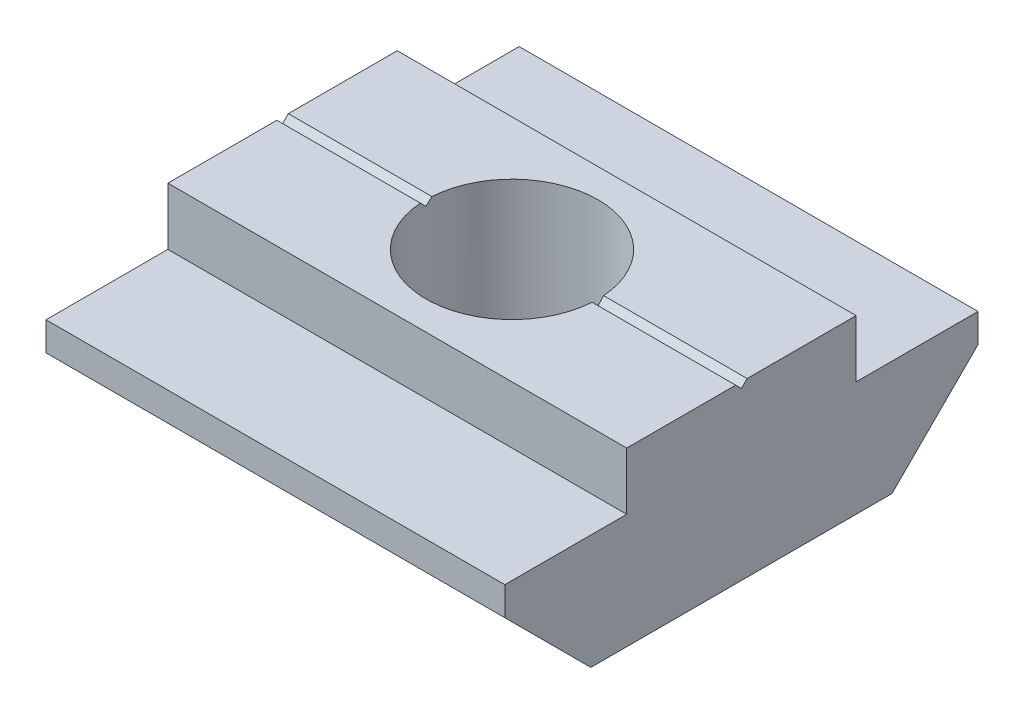
from build123d import *

# Parameters (mm, degrees)
BOSS_EXTRUDE1_DEPTH          = 16
F_6_0_6_DIAMETER_HOLE1_D     = 6
F_6_0_6_DIAMETER_HOLE1_DEPTH = 6


with BuildPart() as part:
    # Sketch1 → Boss-Extrude1 (new body)
    with BuildSketch(Plane(origin=(8, 0, 0), x_dir=(0, 0, -1), z_dir=(1, 0, 0))):
        Polygon((-0.2, 0), (-4, 0), (-4, -2), (-8.25, -2), (-8.25, -3), (-5.25, -6), (5.25, -6), (8.25, -3), (8.25, -2), (4, -2), (4, 0), (0.2, 0), (0, -0.2), align=None)
    extrude(amount=-BOSS_EXTRUDE1_DEPTH)

    # Ø6.0 (6) Diameter Hole1
    with Locations(Plane.XZ.offset(6)):
        with Locations((0, 0)):
            Hole(F_6_0_6_DIAMETER_HOLE1_D / 2, depth=F_6_0_6_DIAMETER_HOLE1_DEPTH)


solid = part.part
